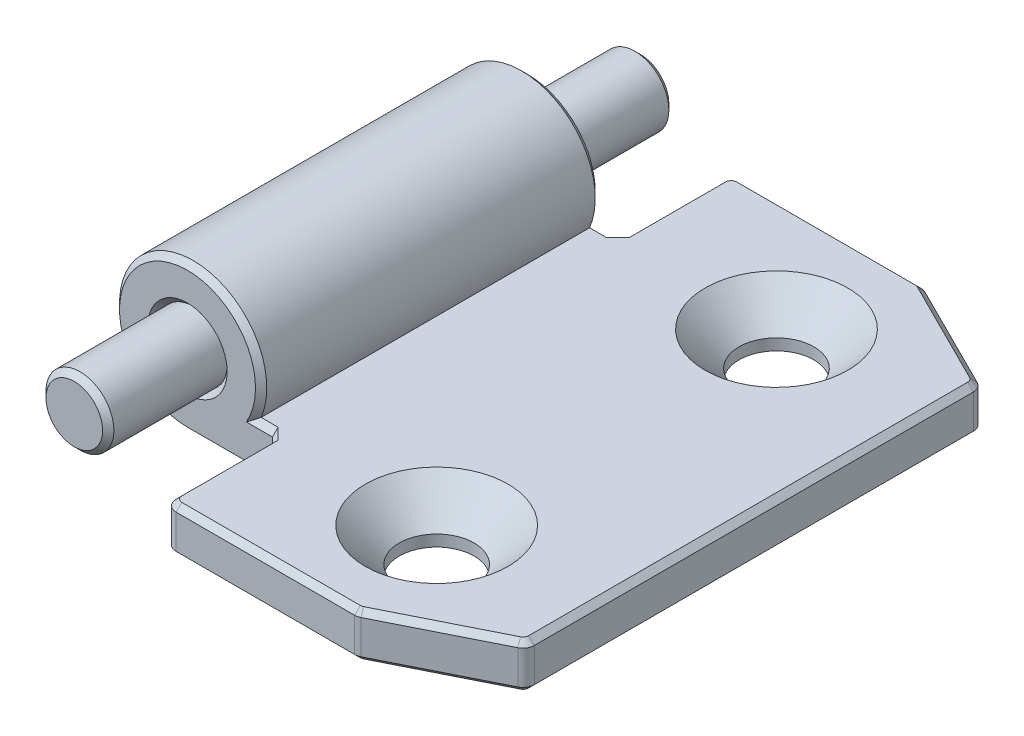
from build123d import *

# Parameters (mm, degrees)
SKETCH2_R                                       = 3
BOSS_EXTRUDE1_DEPTH                             = 25
SKETCH3_W                                       = 30
SKETCH3_H                                       = 25
CUT_EXTRUDE1_DEPTH                              = 45.933283877
CSK_FOR_M6_FLAT_HEAD_MACHINE_SCREW1_D           = 6.6
CSK_FOR_M6_FLAT_HEAD_MACHINE_SCREW1_DEPTH       = 38.017159957
CSK_FOR_M6_FLAT_HEAD_MACHINE_SCREW1_CSINK_D     = 12.6
CSK_FOR_M6_FLAT_HEAD_MACHINE_SCREW1_CSINK_ANGLE = 90
CSK_FOR_M6_FLAT_HEAD_MACHINE_SCREW1_TIP         = 1.982840043
FILLET1_R                                       = 1
CHAMFER1_SIZE                                   = 0.5
SKETCH6_R                                       = 3
BOSS_EXTRUDE2_DEPTH                             = 25
CHAMFER2_SIZE                                   = 0.5


with BuildPart() as part:
    # Sketch2 → Boss-Extrude1 (new, symmetric)
    with BuildSketch(Plane.XY):
        with BuildLine():
            Line((35, 4), (6, 4))
            ThreePointArc((6, 4), (-3.605551275, 11.908326913), (0, 0))
            Line((0, 0), (35, 0))
            Line((35, 0), (35, 4))
        make_face()
        with Locations((0, 6.5)):
            Circle(SKETCH2_R, mode=Mode.SUBTRACT)
    extrude(amount=BOSS_EXTRUDE1_DEPTH, both=True)

    # Sketch3 → Cut-Extrude1 (cut, through all)
    with BuildSketch(Plane(origin=(0, 0, 0), x_dir=(1, 0, 0), z_dir=(0, 1, 0))):
        with Locations((-7, 27.5)):
            Rectangle(SKETCH3_W, SKETCH3_H)
        with Locations((-7, -27.5)):
            Rectangle(SKETCH3_W, SKETCH3_H)
        Polygon((35, 20), (25, 25), (35, 25), align=None)
        Polygon((35, -25), (35, -20), (25, -25), align=None)
    extrude(amount=CUT_EXTRUDE1_DEPTH, mode=Mode.SUBTRACT)

    # CSK for M6 Flat Head Machine Screw1
    with Locations(Plane(origin=(0, 4, 0), x_dir=(1, 0, 0), z_dir=(0, 1, 0))):
        with Locations((22, 15), (22, -15)):
            CounterSinkHole(CSK_FOR_M6_FLAT_HEAD_MACHINE_SCREW1_D / 2, CSK_FOR_M6_FLAT_HEAD_MACHINE_SCREW1_CSINK_D / 2, depth=CSK_FOR_M6_FLAT_HEAD_MACHINE_SCREW1_DEPTH, counter_sink_angle=CSK_FOR_M6_FLAT_HEAD_MACHINE_SCREW1_CSINK_ANGLE)
            with Locations((0, 0, -(CSK_FOR_M6_FLAT_HEAD_MACHINE_SCREW1_DEPTH + CSK_FOR_M6_FLAT_HEAD_MACHINE_SCREW1_TIP / 2))):  # 118° drill point
                Cone(0, CSK_FOR_M6_FLAT_HEAD_MACHINE_SCREW1_D / 2, CSK_FOR_M6_FLAT_HEAD_MACHINE_SCREW1_TIP, mode=Mode.SUBTRACT)

    # Fillet1
    fillet1_edges = [part.edges().sort_by_distance(p)[0] for p in [
        (8, 2, -25),
        (25, 2, -25),
        (25, 2, 25),
        (8, 2, 25),
        (35, 2, -20),
        (35, 2, 20),
    ]]
    fillet(fillet1_edges, radius=FILLET1_R)

    # Chamfer1
    chamfer1_edges = [part.edges().sort_by_distance(p)[0] for p in [
        (29.829179607, 4, -22.585410197),
        (29.829179607, 0, -22.585410197),
        (8, 4, 19.5),
        (16.881966011, 4, 25),
        (29.829179607, 4, 22.585410197),
        (35, 4, 0),
        (16.881966011, 4, -25),
        (8.292893219, 4, -24.707106781),
        (8.292893219, 4, 24.707106781),
        (24.993684943, 4, 24.973248989),
        (34.850650808, 4, 19.907697123),
        (34.850650808, 4, -19.907697123),
        (24.993684943, 4, -24.973248989),
        (16.881966011, 0, -25),
        (8, 0, 19.5),
        (35, 0, 0),
        (29.829179607, 0, 22.585410197),
        (16.881966011, 0, 25),
        (8.292893219, 0, -24.707106781),
        (8.292893219, 0, 24.707106781),
        (24.993684943, 0, 24.973248989),
        (34.850650808, 0, 19.907697123),
        (34.850650808, 0, -19.907697123),
        (24.993684943, 0, -24.973248989),
        (-3, 6.5, 15),
        (8, 2, 15),
        (4, 0, 15),
        (7, 4, 15),
        (-3.605551275, 11.908326913, 15),
        (-3, 6.5, -15),
        (4, 0, -15),
        (-3.605551275, 11.908326913, -15),
        (7, 4, -15),
        (8, 2, -15),
        (8, 0, -19.5),
        (8, 4, -19.5),
    ]]
    chamfer(chamfer1_edges, length=CHAMFER1_SIZE)


with BuildPart() as body_2:
    # Sketch6 → Boss-Extrude2 (new, symmetric)
    with BuildSketch(Plane.XY):
        with Locations((0, 6.5)):
            Circle(SKETCH6_R)
    extrude(amount=BOSS_EXTRUDE2_DEPTH, both=True)

    # Chamfer2
    chamfer2_edges = [body_2.edges().sort_by_distance(p)[0] for p in [
        (-3, 6.5, -25),
        (-3, 6.5, 25),
    ]]
    chamfer(chamfer2_edges, length=CHAMFER2_SIZE)


solid = Compound([part.part, body_2.part])
